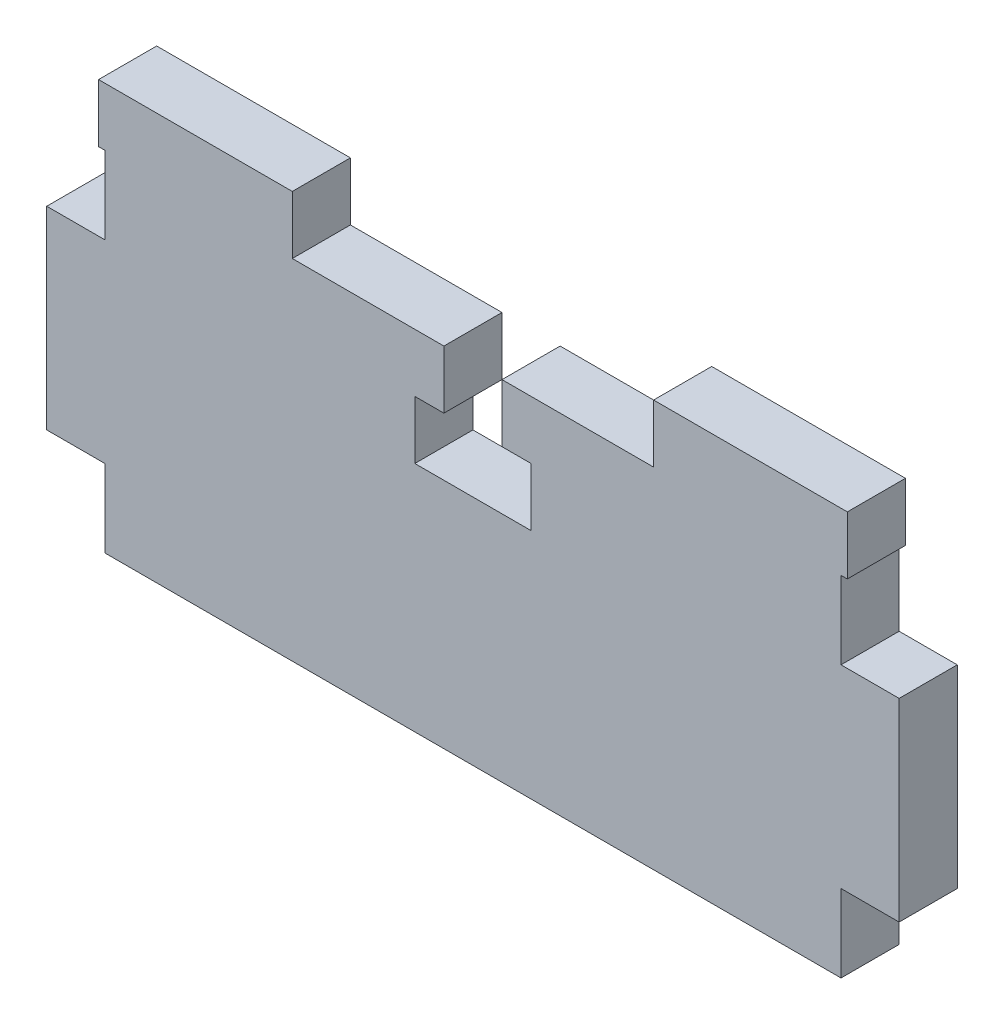
from build123d import *

# Parameters (mm, degrees)
SALIENTE_EXTRUIR2_DEPTH = 3
CROQUIS2_W              = 3
CROQUIS2_H              = 10
SALIENTE_EXTRUIR3_DEPTH = 3
CROQUIS3_W              = 10
CROQUIS3_H              = 3
SALIENTE_EXTRUIR4_DEPTH = 3


with BuildPart() as part:
    # Croquis1 → Saliente-Extruir2 (new body)
    with BuildSketch(Plane.XY):
        Polygon((19, -9), (-19, -9), (-19, 9), (-1.5, 9), (-1.5, 6), (-3, 6), (-3, 3), (3, 3), (3, 6), (1.5, 6), (1.5, 9), (19, 9), align=None)
    extrude(amount=SALIENTE_EXTRUIR2_DEPTH)

    # Croquis2 → Saliente-Extruir3 (add)
    with BuildSketch(Plane(origin=(19, 0, 0), x_dir=(0, 0, -1), z_dir=(1, 0, 0))):
        with Locations((-1.5, 0)):
            Rectangle(CROQUIS2_W, CROQUIS2_H)
    saliente_extruir3 = extrude(amount=SALIENTE_EXTRUIR3_DEPTH)

    # Croquis3 → Saliente-Extruir4 (add)
    with BuildSketch(Plane(origin=(0, 9, 0), x_dir=(1, 0, 0), z_dir=(0, 1, 0))):
        with Locations((14.325, -1.5)):
            Rectangle(CROQUIS3_W, CROQUIS3_H)
    saliente_extruir4 = extrude(amount=SALIENTE_EXTRUIR4_DEPTH)

    # Simetría1: Saliente-Extruir3 across plane
    add(saliente_extruir3.mirror(Plane(origin=(0, 0, 0), x_dir=(0, 0, 1), z_dir=(1, 0, 0))))

    # Simetría2: Saliente-Extruir4 across plane
    add(saliente_extruir4.mirror(Plane(origin=(0, 0, 0), x_dir=(0, 0, 1), z_dir=(1, 0, 0))))


solid = part.part
